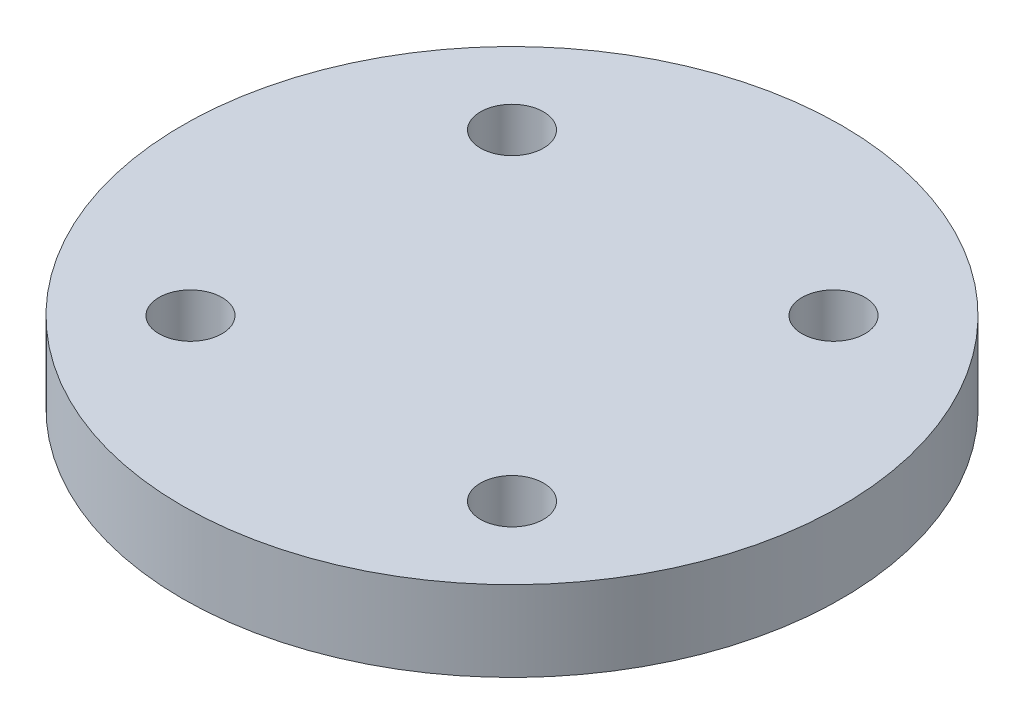
from build123d import *

# Parameters (mm, degrees)
SKETCH1_R           = 26.035
SKETCH1_R_2         = 2.4892
BOSS_EXTRUDE1_DEPTH = 6.35


with BuildPart() as part:
    # Sketch1 → Boss-Extrude1 (new body)
    with BuildSketch(Plane(origin=(0, 0, 0), x_dir=(1, 0, 0), z_dir=(0, 1, 0))):
        with Locations(Location((0, 0, 0), (0, 0, 270))):
            Circle(SKETCH1_R)
        with Locations(Location((-12.7, 12.7, 0), (0, 0, 270))):
            Circle(SKETCH1_R_2, mode=Mode.SUBTRACT)
        with Locations(Location((-12.7, -12.7, 0), (0, 0, 270))):
            Circle(SKETCH1_R_2, mode=Mode.SUBTRACT)
        with Locations(Location((12.7, -12.7, 0), (0, 0, 270))):
            Circle(SKETCH1_R_2, mode=Mode.SUBTRACT)
        with Locations(Location((12.7, 12.7, 0), (0, 0, 270))):
            Circle(SKETCH1_R_2, mode=Mode.SUBTRACT)
    extrude(amount=BOSS_EXTRUDE1_DEPTH)


solid = part.part
